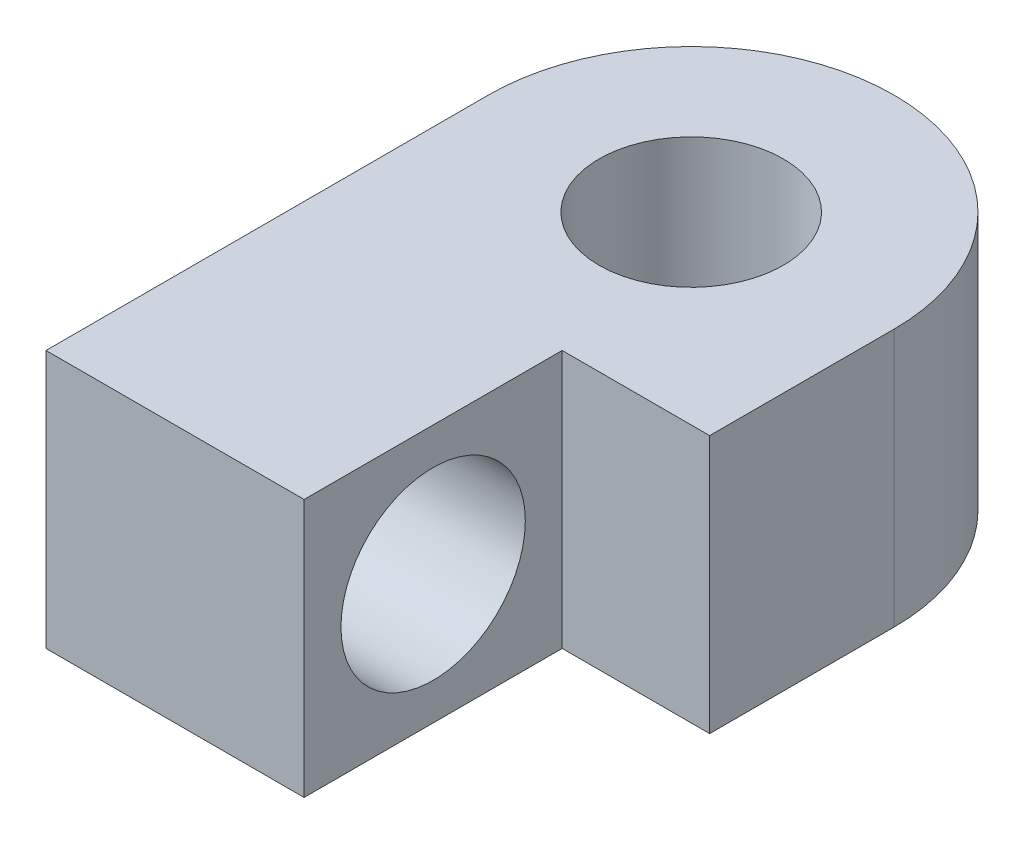
from build123d import *

# Parameters (mm, degrees)
CROQUIS1_R              = 2.5
SALIENTE_EXTRUIR1_DEPTH = 7
CROQUIS3_R              = 2.5
CORTAR_EXTRUIR1_DEPTH   = 17


with BuildPart() as part:
    # Croquis1 → Saliente-Extruir1 (new body)
    with BuildSketch(Plane(origin=(0, 0, 0), x_dir=(1, 0, 0), z_dir=(0, 1, 0))):
        with BuildLine():
            Line((-5.5, 0), (-5.5, -12))
            Line((-5.5, -12), (1.5, -12))
            Line((1.5, -12), (1.5, -5))
            Line((1.5, -5), (5.5, -5))
            Line((5.5, -5), (5.5, 0))
            ThreePointArc((5.5, 0), (0, 5.5), (-5.5, 0))
        make_face()
        with Locations(Location((0, 0, 0), (0, 0, 270))):
            Circle(CROQUIS1_R, mode=Mode.SUBTRACT)
    extrude(amount=SALIENTE_EXTRUIR1_DEPTH)

    # Croquis3 → Cortar-Extruir1 (cut)
    with BuildSketch(Plane.ZY.offset(5.5)):
        with Locations((8.5, 3.5)):
            Circle(CROQUIS3_R)
    extrude(amount=-CORTAR_EXTRUIR1_DEPTH, mode=Mode.SUBTRACT)


solid = part.part
